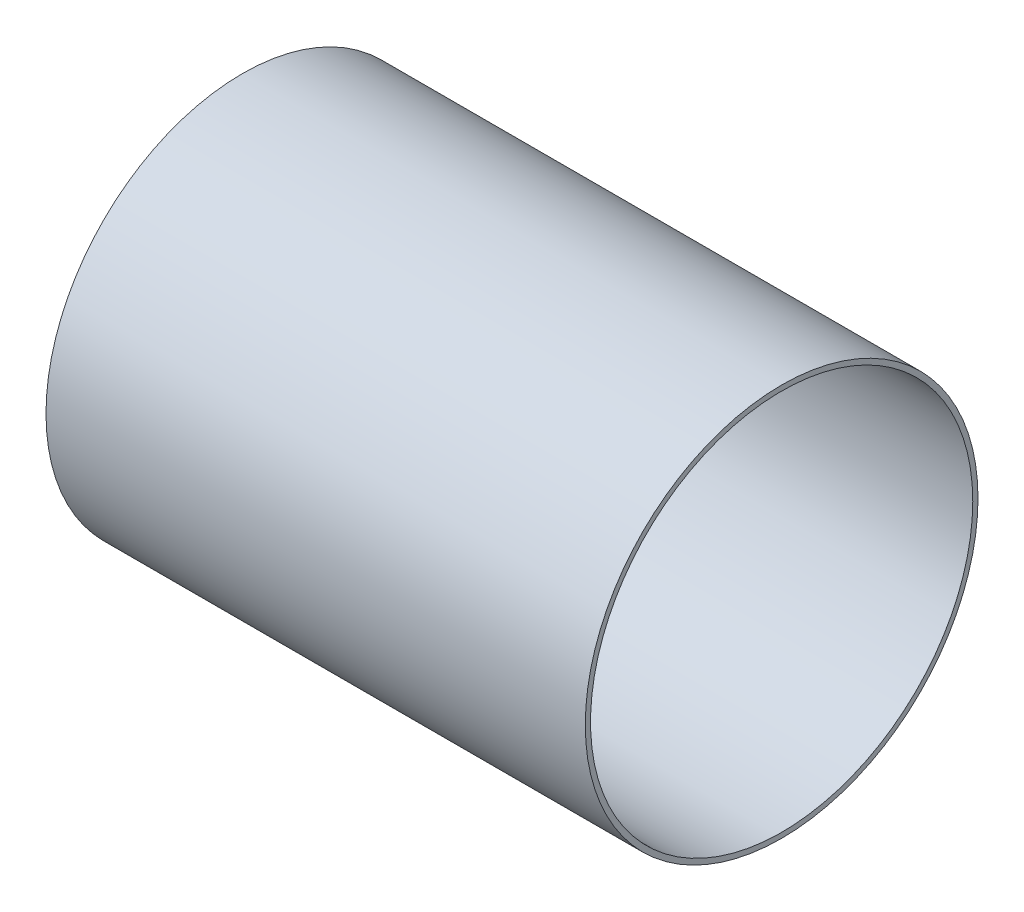
from build123d import *

# Parameters (mm, degrees)
SKETCH1_R           = 75
SKETCH1_R_2         = 73
BOSS_EXTRUDE1_DEPTH = 206


with BuildPart() as part:
    # Sketch1 → Boss-Extrude1 (new body)
    with BuildSketch(Plane(origin=(0, 0, 0), x_dir=(0, 0, -1), z_dir=(1, 0, 0))):
        Circle(SKETCH1_R)
        Circle(SKETCH1_R_2, mode=Mode.SUBTRACT)
    extrude(amount=BOSS_EXTRUDE1_DEPTH)


solid = part.part
